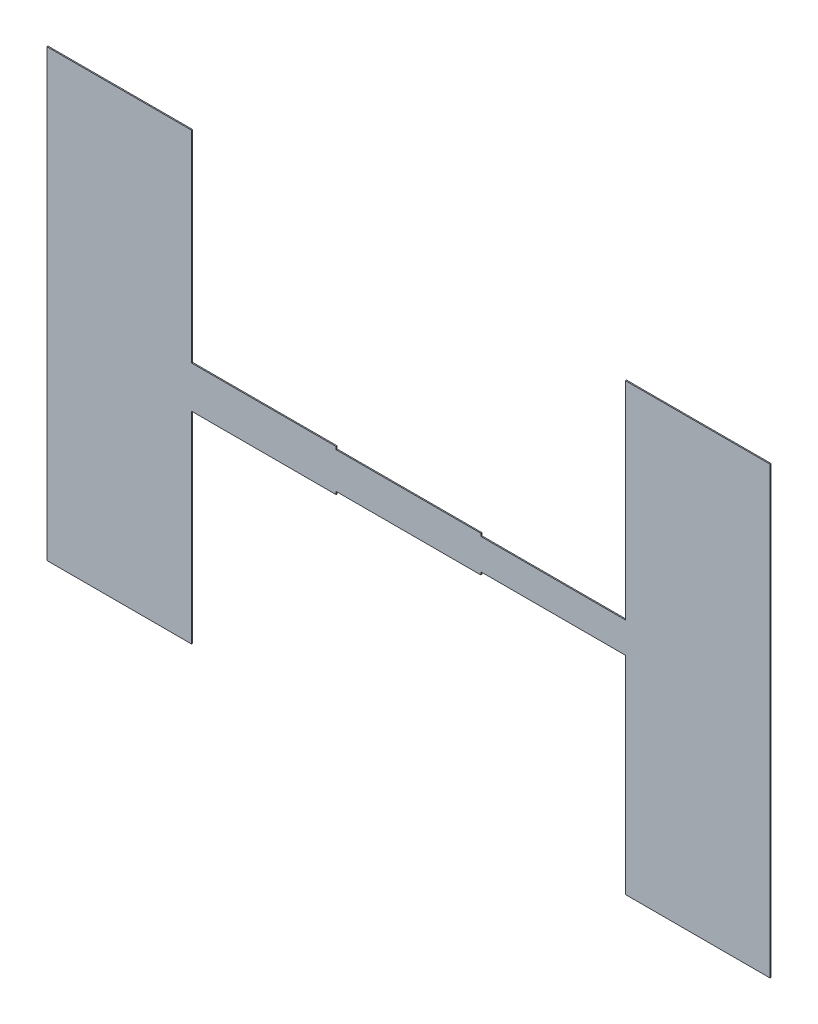
from build123d import *

# Parameters (mm, degrees)
BOSS_EXTRUDE1_DEPTH = 10


with BuildPart() as part:
    # Sketch1 → Boss-Extrude1 (new body)
    with BuildSketch(Plane.XY):
        Polygon((-650, -2000), (650, -2000), (650, -187.5), (1950, -187.5), (1950, -162.5), (3250, -162.5), (3250, -137.5), (4550, -137.5), (4550, -2000), (5850, -2000), (5850, 2000), (4550, 2000), (4550, 137.5), (3250, 137.5), (3250, 162.5), (1950, 162.5), (1950, 187.5), (650, 187.5), (650, 2000), (-650, 2000), align=None)
    extrude(amount=BOSS_EXTRUDE1_DEPTH)


solid = part.part
